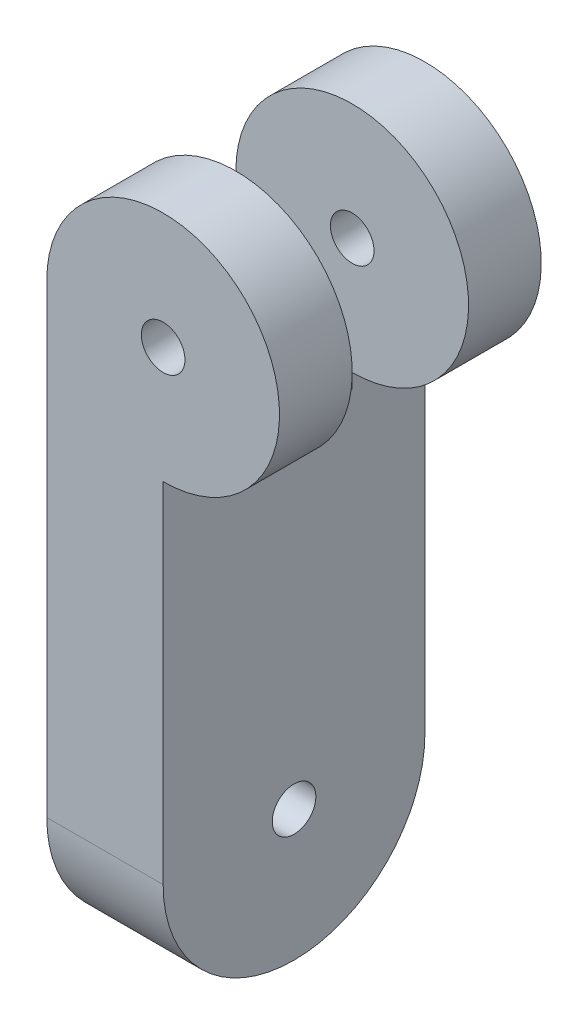
from build123d import *

# Parameters (mm, degrees)
SKETCH_1_R          = 3
EXTRUDE_1_DEPTH     = 16
SKETCH_3_W          = 16
SKETCH_3_H          = 32
EXTRUDE_2_DEPTH     = 36
SKETCH_5_R          = 3
CUT_EXTRUDE_1_DEPTH = 36
SKETCH_8_R          = 18
CUT_EXTRUDE_6_DEPTH = 8


with BuildPart() as part:
    # 草图1 → 凸台-拉伸1 (new body)
    with BuildSketch(Plane(origin=(0, 0, 0), x_dir=(0, 0, -1), z_dir=(1, 0, 0))):
        with BuildLine():
            Line((-18, 0), (-18, 80))
            Line((-18, 80), (18, 80))
            Line((18, 80), (18, 0))
            ThreePointArc((18, 0), (0, -18), (-18, 0))
        make_face()
        Circle(SKETCH_1_R, mode=Mode.SUBTRACT)
    extrude(amount=EXTRUDE_1_DEPTH)

    # 草图3 → 凸台-拉伸2 (add)
    with BuildSketch(Plane(origin=(0, 0, -18), x_dir=(-1, 0, 0), z_dir=(0, 0, -1))):
        with Locations((-24, 64)):
            Rectangle(SKETCH_3_W, SKETCH_3_H)
    extrude(amount=-EXTRUDE_2_DEPTH)

    # 草图5 → 切除-拉伸1 (cut)
    with BuildSketch(Plane(origin=(0, 0, -18), x_dir=(-1, 0, 0), z_dir=(0, 0, -1))):
        with Locations((-16, 64)):
            Circle(SKETCH_5_R)
        with BuildLine():
            Line((-16, 92.996070946), (8.992787367, 92.996070946))
            Line((8.992787367, 92.996070946), (8.992787367, 64))
            Line((8.992787367, 64), (0, 64))
            ThreePointArc((0, 64), (-27.313708499, 75.313708499), (-16, 48))
            Line((-16, 48), (-16, 39.001100245))
            Line((-16, 39.001100245), (-49.117406919, 39.001100245))
            Line((-49.117406919, 39.001100245), (-49.117406919, 92.996070946))
            Line((-49.117406919, 92.996070946), (-16, 92.996070946))
        make_face()
    extrude(amount=-CUT_EXTRUDE_1_DEPTH, mode=Mode.SUBTRACT)

    # 草图8 → 切除-拉伸6 (cut, symmetric)
    with BuildSketch(Plane.XY):
        with Locations((16, 64)):
            Circle(SKETCH_8_R)
    extrude(amount=CUT_EXTRUDE_6_DEPTH, both=True, mode=Mode.SUBTRACT)


solid = part.part
